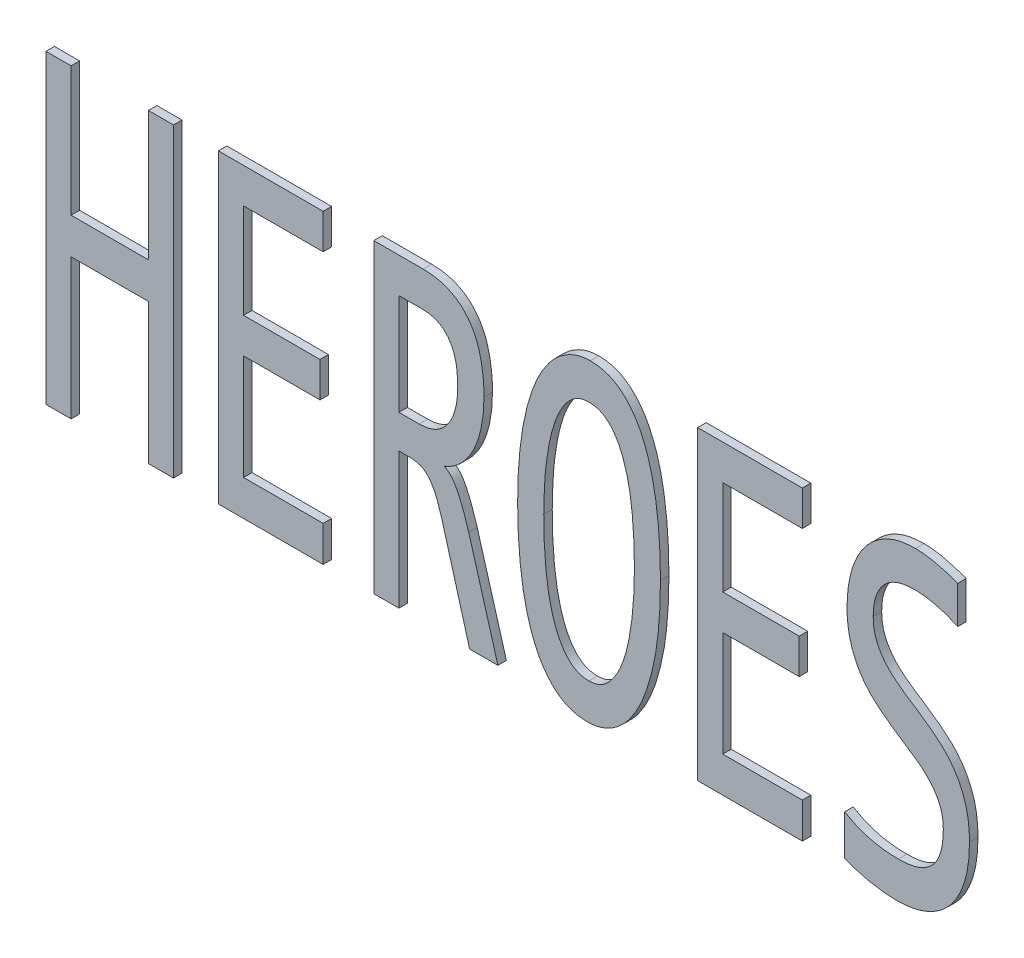
from build123d import *

# Parameters (mm, degrees)
BOSS_EXTRUDE1_DEPTH   = 25.4
BOSS_EXTRUDE1_2_DEPTH = 25.4
BOSS_EXTRUDE1_3_DEPTH = 25.4
BOSS_EXTRUDE1_4_DEPTH = 25.4
BOSS_EXTRUDE1_5_DEPTH = 25.4
BOSS_EXTRUDE1_6_DEPTH = 25.4


with BuildPart() as part:
    # Sketch1 → Boss-Extrude1 (new body)
    with BuildSketch(Plane.XY):
        Polygon((427.867059624, 0), (352.824484244, 0), (352.824484244, 419.782362276), (121.685060077, 419.782362276), (121.685060077, 0), (46.642484697, 0), (46.642484697, 914.4), (121.685060077, 914.4), (121.685060077, 527.57832691), (352.824484244, 527.57832691), (352.824484244, 914.4), (427.867059624, 914.4), align=None)
    extrude(amount=BOSS_EXTRUDE1_DEPTH)


with BuildPart() as body_2:
    # Sketch1 → Boss-Extrude1 2 (new body)
    with BuildSketch(Plane.XY):
        Polygon((875.220312854, 0), (562.197415552, 0), (562.197415552, 914.4), (875.220312854, 914.4), (875.220312854, 809.506234414), (637.239990932, 809.506234414), (637.239990932, 526.127227386), (865.891815915, 526.127227386), (865.891815915, 421.2334618), (637.239990932, 421.2334618), (637.239990932, 106.34486511), (875.220312854, 106.34486511), align=None)
    extrude(amount=BOSS_EXTRUDE1_2_DEPTH)


with BuildPart() as body_3:
    # Sketch1 → Boss-Extrude1 3 (new body)
    with BuildSketch(Plane.XY):
        with BuildLine():
            Line((1397.823441397, 0), (1313.245069145, 0))
            Line((1313.245069145, 0), (1230.946996146, 292.500204035))
            add(Edge.make_bspline(
                [(1230.946996146, 292.500204035), (1227.979518294, 302.771324606), (1222.546695751, 321.57556786), (1213.096231071, 346.863351802), (1202.953237547, 366.967967822), (1192.083790683, 382.586832065), (1180.311745272, 394.277562879), (1167.142347377, 402.126164109), (1152.563959108, 406.303675145), (1142.455396668, 406.85369441), (1137.247426887, 407.137066425)],
                knots=[0, 0, 0, 0, 1.597716288, 2.925079646, 4.029118855, 4.95483166, 5.758333448, 6.489909429, 7.2219956, 8, 8, 8, 8], degree=3))
            Line((1137.247426887, 407.137066425), (1101.799138517, 407.137066425))
            Line((1101.799138517, 407.137066425), (1101.799138517, 0))
            Line((1101.799138517, 0), (1026.756563138, 0))
            Line((1026.756563138, 0), (1026.756563138, 914.4))
            Line((1026.756563138, 914.4), (1174.146814781, 914.4))
            add(Edge.make_bspline(
                [(1174.146814781, 914.4), (1181.898188678, 914.228278779), (1196.924702681, 913.895386654), (1218.579968137, 910.561725178), (1238.486929114, 904.95554821), (1256.674416627, 897.177581238), (1273.379235464, 887.67019673), (1288.369232426, 876.164398357), (1301.830726141, 862.951477663), (1313.566458895, 847.940826388), (1324.089949237, 831.398133709), (1332.94682864, 813.164772671), (1340.181413566, 793.183858664), (1346.153657472, 771.770464689), (1350.597077572, 748.947014088), (1354.000197251, 724.946575766), (1355.794225717, 699.734284683), (1356.03400427, 682.502961384), (1356.156155067, 673.724778962)],
                knots=[0, 0, 0, 0, 1.084866721, 2.103080717, 3.058771504, 3.973613724, 4.866598079, 5.743338747, 6.612355622, 7.500977648, 8.405681801, 9.353452431, 10.33314081, 11.377907751, 12.463421626, 13.586957847, 14.77071982, 16, 16, 16, 16], degree=3))
            add(Edge.make_bspline(
                [(1356.156155067, 673.724778962), (1355.836051248, 659.8816854), (1355.208875166, 632.759056266), (1349.216118496, 593.530858206), (1340.163355749, 556.960415637), (1326.89859319, 523.893408489), (1310.097806514, 494.51804159), (1292.991429553, 473.359983954), (1277.64962045, 458.996069072), (1265.26759342, 449.889702798), (1252.287800383, 441.805046815), (1242.894117469, 437.90140806), (1238.202493766, 435.951756971)],
                knots=[0, 0, 0, 0, 1.475754456, 2.891430345, 4.223375743, 5.486798079, 6.679060895, 7.821114891, 8.374012476, 8.916543086, 9.458873353, 10, 10, 10, 10], degree=3))
            add(Edge.make_bspline(
                [(1238.202493766, 435.951756971), (1242.032634048, 433.453078043), (1249.964403927, 428.278607973), (1260.397392689, 417.612945744), (1269.605712994, 404.383141179), (1278.17802475, 388.767276487), (1286.090376518, 370.519761878), (1294.423645601, 349.819806792), (1302.717288962, 326.302732684), (1307.849424868, 309.588127561), (1310.550170029, 300.792201315)],
                knots=[0, 0, 0, 0, 0.699819309, 1.44924345, 2.269785885, 3.166405396, 4.176878175, 5.318367018, 6.588812254, 8, 8, 8, 8], degree=3))
            Line((1310.550170029, 300.792201315), (1397.823441397, 0))
        make_face()
        with BuildLine():
            add(Edge.make_bspline(
                [(1277.796780775, 663.359782362), (1277.541949658, 674.852379904), (1277.064524205, 696.383732306), (1271.962412493, 726.445269855), (1263.392108741, 751.98738049), (1251.304645946, 773.06215327), (1235.854313769, 789.563825107), (1217.239481021, 801.288316371), (1195.710930946, 808.343441684), (1180.420286839, 809.109071476), (1172.488415325, 809.506234414)],
                knots=[0, 0, 0, 0, 1.351163771, 2.531401905, 3.572722056, 4.505560823, 5.368195232, 6.20500384, 7.068863365, 8, 8, 8, 8], degree=3))
            Line((1172.488415325, 809.506234414), (1101.799138517, 809.506234414))
            Line((1101.799138517, 809.506234414), (1101.799138517, 507.262933575))
            Line((1101.799138517, 507.262933575), (1162.330718658, 507.262933575))
            add(Edge.make_bspline(
                [(1162.330718658, 507.262933575), (1170.826414673, 507.682168298), (1187.299417774, 508.495056952), (1210.506895012, 516.514249205), (1230.695992445, 529.448932997), (1247.615021643, 547.401764203), (1260.933862287, 570.095760397), (1270.489698163, 597.324829639), (1276.826103242, 628.870269637), (1277.461319048, 651.440364116), (1277.796780775, 663.359782362)],
                knots=[0, 0, 0, 0, 0.929748386, 1.802765544, 2.659017934, 3.53879539, 4.484401355, 5.525688525, 6.693299518, 8, 8, 8, 8], degree=3))
        make_face(mode=Mode.SUBTRACT)
    extrude(amount=BOSS_EXTRUDE1_3_DEPTH)


with BuildPart() as body_4:
    # Sketch1 → Boss-Extrude1 4 (new body)
    with BuildSketch(Plane.XY):
        with BuildLine():
            add(Edge.make_bspline(
                [(1883.734481977, 463.108048062), (1883.574683507, 443.270570704), (1883.266533963, 405.016702526), (1879.81894014, 349.691916761), (1874.680071132, 298.528368242), (1866.956284887, 251.487861786), (1857.459451284, 208.599987821), (1846.512320437, 169.513505194), (1833.9989034, 134.353393879), (1819.989144666, 102.99318291), (1804.265331117, 75.73568026), (1787.90188433, 51.770403755), (1769.633807411, 31.89197751), (1750.381163492, 15.562337758), (1730.078179094, 2.992683205), (1709.234239782, -6.090868019), (1687.622662663, -11.49365712), (1673.008915389, -12.259770567), (1665.654953525, -12.645295851)],
                knots=[0, 0, 0, 0, 1.665621615, 3.211924003, 4.653104377, 5.98196857, 7.212423904, 8.340265313, 9.388303699, 10.34396813, 11.219884416, 12.028020766, 12.775508547, 13.479835242, 14.141671432, 14.773311111, 15.382702934, 16, 16, 16, 16], degree=3))
            add(Edge.make_bspline(
                [(1665.654953525, -12.645295851), (1657.053254418, -12.236219338), (1640.267690367, -11.437937517), (1615.875909346, -5.462297291), (1593.292219548, 4.59076045), (1572.439277542, 18.700254), (1553.868149934, 36.944311842), (1536.380246362, 58.171933485), (1521.295504003, 83.382379759), (1507.235037026, 111.638962697), (1495.439250098, 143.630021), (1484.864476744, 178.703668774), (1476.283359636, 217.190892788), (1469.069418548, 258.693855544), (1463.538445109, 303.31925884), (1459.667860075, 350.69396238), (1457.401816412, 400.826751362), (1457.07293091, 435.120204855), (1456.903922013, 452.743051462)],
                knots=[0, 0, 0, 0, 0.735650079, 1.435565388, 2.134455729, 2.841355824, 3.577481098, 4.35511842, 5.188811928, 6.085340591, 7.052928526, 8.102480853, 9.218544296, 10.425035792, 11.706416624, 13.065252835, 14.491881282, 16, 16, 16, 16], degree=3))
            add(Edge.make_bspline(
                [(1456.903922013, 452.743051462), (1457.067079198, 472.372931117), (1457.38215837, 510.280953691), (1460.795083327, 565.12670817), (1466.047531562, 615.987385125), (1473.481337366, 662.902231716), (1482.741056164, 705.890610397), (1493.711490252, 744.928005442), (1505.995910823, 780.153164648), (1520.120839327, 811.420075808), (1535.634462222, 838.929049683), (1552.379211397, 862.676620083), (1570.294311993, 882.807314841), (1589.719623565, 898.809789824), (1609.926763279, 911.419961931), (1630.785177291, 920.487989856), (1652.325847076, 925.876488243), (1666.869683995, 926.655241812), (1674.154250737, 927.045295851)],
                knots=[0, 0, 0, 0, 1.653336302, 3.19282191, 4.626902271, 5.958966435, 7.191994487, 8.32894068, 9.372796068, 10.331429196, 11.215122592, 12.029126862, 12.77501786, 13.477806185, 14.141698318, 14.775300137, 15.386584988, 16, 16, 16, 16], degree=3))
            add(Edge.make_bspline(
                [(1674.154250737, 927.045295851), (1682.757354678, 926.645455715), (1699.629368676, 925.861307525), (1724.046370376, 919.718856926), (1746.587783112, 909.342454375), (1767.316419742, 895.002114086), (1786.174955067, 876.929618589), (1803.590389679, 855.529775526), (1818.992569134, 830.47613045), (1832.877687079, 802.133406453), (1845.030331004, 770.473611634), (1855.582111305, 735.630924665), (1864.145028116, 697.41826109), (1871.381011852, 656.122916328), (1876.809298273, 611.759214967), (1881.069439464, 564.618672406), (1883.204850875, 514.745705249), (1883.555155229, 480.591940324), (1883.734481977, 463.108048062)],
                knots=[0, 0, 0, 0, 0.737510061, 1.446371002, 2.144062571, 2.856089632, 3.598373578, 4.37797704, 5.216905352, 6.115700755, 7.082323301, 8.123178058, 9.236284327, 10.439986157, 11.71872477, 13.069688123, 14.499923588, 16, 16, 16, 16], degree=3))
        make_face()
        with BuildLine():
            add(Edge.make_bspline(
                [(1805.997007481, 453.986851054), (1805.942236052, 467.117629707), (1805.834963475, 492.834914575), (1804.267571306, 530.570435927), (1802.130296679, 566.600308326), (1798.742402379, 600.740396233), (1794.7500373, 632.933770615), (1789.44128313, 662.917427661), (1782.776395017, 690.58266607), (1775.182881553, 715.881045185), (1766.586460927, 738.767086134), (1756.739223253, 759.005482991), (1745.398626175, 776.429927201), (1733.098508617, 791.30788944), (1719.301558862, 803.196528359), (1704.085869616, 811.665626702), (1687.484570395, 816.921283907), (1675.92064413, 817.501552552), (1670.008252097, 817.798231693)],
                knots=[0, 0, 0, 0, 1.494673396, 2.92739239, 4.298855107, 5.602877083, 6.83225648, 7.991056563, 9.06712614, 10.069974831, 10.996192196, 11.847531562, 12.626450823, 13.357675176, 14.038550396, 14.686455743, 15.328412477, 16, 16, 16, 16], degree=3))
            add(Edge.make_bspline(
                [(1670.008252097, 817.798231693), (1664.306536825, 817.410050532), (1653.009247086, 816.640914431), (1636.662308167, 811.349009536), (1621.832044526, 802.017225841), (1608.426180767, 789.394826636), (1596.180377617, 773.894349993), (1585.296352253, 755.676019042), (1575.305191361, 735.100521557), (1566.741991728, 711.993832167), (1559.119161799, 686.71074256), (1552.496408531, 659.232023469), (1546.965311259, 629.61026497), (1540.852111554, 586.75691587), (1536.093428988, 529.823005534), (1535.271338587, 483.433237641), (1534.848696441, 459.583949218)],
                knots=[0, 0, 0, 0, 0.579173738, 1.147565815, 1.724351549, 2.345416426, 3.009887506, 3.725127234, 4.497589357, 5.330835328, 6.225914732, 7.179521756, 8.201254399, 9.286505257, 11.576760982, 14, 14, 14, 14], degree=3))
            add(Edge.make_bspline(
                [(1534.848696441, 459.583949218), (1534.904630459, 446.384195428), (1535.014191961, 420.529002039), (1536.562957071, 382.653536342), (1538.750870758, 346.491012199), (1542.012053343, 312.256911958), (1546.35305332, 280.0994899), (1551.605166354, 250.167606319), (1558.312832155, 222.673160533), (1565.617688608, 197.448867298), (1574.236628105, 174.781158315), (1584.253693989, 154.76577009), (1595.154735778, 137.1684608), (1607.343406897, 122.290004201), (1620.941729764, 110.316354967), (1636.144900837, 101.91341807), (1652.670941621, 96.668756323), (1664.165181212, 96.074604383), (1670.008252097, 95.772568579)],
                knots=[0, 0, 0, 0, 1.504779654, 2.947507171, 4.321014867, 5.634822696, 6.867068139, 8.019842616, 9.097516712, 10.092049308, 11.012292271, 11.85784749, 12.640311336, 13.367565975, 14.043468617, 14.69234005, 15.335254001, 16, 16, 16, 16], degree=3))
            add(Edge.make_bspline(
                [(1670.008252097, 95.772568579), (1675.709696874, 96.160944594), (1687.006450659, 96.930466775), (1703.357371273, 102.219503419), (1718.17195522, 111.562582123), (1731.682309762, 124.175555671), (1743.668353757, 139.904023718), (1755.05832443, 157.840170272), (1764.851395095, 178.532220433), (1773.702115426, 201.55931102), (1781.602259537, 226.887550769), (1788.068039786, 254.424585522), (1793.692914665, 283.955822321), (1799.770100815, 326.683305772), (1804.836499163, 383.596318787), (1805.602631534, 430.066011855), (1805.997007481, 453.986851054)],
                knots=[0, 0, 0, 0, 0.578826107, 1.146877024, 1.723316561, 2.344008663, 3.013581566, 3.726115412, 4.498113888, 5.333368672, 6.229972404, 7.189827678, 8.204052998, 9.281707645, 11.571201674, 14, 14, 14, 14], degree=3))
        make_face(mode=Mode.SUBTRACT)
    extrude(amount=BOSS_EXTRUDE1_4_DEPTH)


with BuildPart() as body_5:
    # Sketch1 → Boss-Extrude1 5 (new body)
    with BuildSketch(Plane.XY):
        Polygon((2308.077442757, 0), (1995.054545455, 0), (1995.054545455, 914.4), (2308.077442757, 914.4), (2308.077442757, 809.506234414), (2070.097120834, 809.506234414), (2070.097120834, 526.127227386), (2298.748945817, 526.127227386), (2298.748945817, 421.2334618), (2070.097120834, 421.2334618), (2070.097120834, 106.34486511), (2308.077442757, 106.34486511), align=None)
    extrude(amount=BOSS_EXTRUDE1_5_DEPTH)


with BuildPart() as body_6:
    # Sketch1 → Boss-Extrude1 6 (new body)
    with BuildSketch(Plane.XY):
        with BuildLine():
            add(Edge.make_bspline(
                [(2807.87757878, 247.723418726), (2807.670726836, 237.213588778), (2807.268446066, 216.774320003), (2804.390336146, 187.105134166), (2799.510370083, 159.408895406), (2792.392388888, 133.860323347), (2783.746816976, 110.303904248), (2773.311445081, 88.788951862), (2761.374350166, 69.276601601), (2747.773050163, 51.928268599), (2732.78040092, 36.565506393), (2716.037338932, 23.588145969), (2698.107446952, 12.143445685), (2678.594013063, 3.175349319), (2657.91301498, -3.99413532), (2636.1263074, -8.797347604), (2613.323499997, -12.109910648), (2597.756980324, -12.464168884), (2589.798050329, -12.645295851)],
                knots=[0, 0, 0, 0, 1.310582108, 2.548789095, 3.713439669, 4.813153502, 5.852028856, 6.838695823, 7.790539703, 8.699031485, 9.582618121, 10.460132505, 11.335231648, 12.229636156, 13.131688288, 14.059871096, 15.008040946, 16, 16, 16, 16], degree=3))
            add(Edge.make_bspline(
                [(2589.798050329, -12.645295851), (2582.469288478, -12.538191145), (2567.85097377, -12.324554745), (2546.171041654, -10.226958691), (2525.097511639, -6.646531308), (2504.651025303, -3.278014054), (2485.389301521, 1.754641289), (2467.188594068, 6.724524486), (2450.434312287, 12.584355464), (2439.836814427, 16.824228187), (2434.737701202, 18.864293811)],
                knots=[0, 0, 0, 0, 1.104818042, 2.203725289, 3.279421478, 4.327776895, 5.325902173, 6.279022676, 7.171931115, 8, 8, 8, 8], degree=3))
            Line((2434.737701202, 18.864293811), (2434.737701202, 139.305554296))
            add(Edge.make_bspline(
                [(2434.737701202, 139.305554296), (2445.766452904, 133.075336977), (2468.368711704, 120.307166289), (2499.699021357, 109.807210696), (2526.436908603, 102.968749668), (2548.27982185, 99.990399509), (2571.288182936, 97.414579633), (2587.094639556, 97.288316995), (2595.18784856, 97.223668102)],
                knots=[0, 0, 0, 0, 1.354118707, 2.775122905, 3.521931415, 4.308088204, 5.133708705, 6, 6, 6, 6], degree=3))
            add(Edge.make_bspline(
                [(2595.18784856, 97.223668102), (2600.995597756, 97.355640783), (2612.221093693, 97.610723904), (2628.392567083, 99.199735524), (2643.25398516, 102.093170728), (2656.831735632, 106.204342669), (2669.112495166, 111.633393445), (2680.200553137, 118.062729554), (2690.112757266, 125.635470158), (2701.831671092, 137.33664401), (2713.562528053, 155.25324581), (2723.099058285, 180.440337202), (2728.578446061, 209.344298928), (2729.19413773, 229.871050429), (2729.518204489, 240.675221038)],
                knots=[0, 0, 0, 0, 0.924336143, 1.78660119, 2.582421721, 3.330297934, 4.039326715, 4.714545517, 5.365600794, 6.018788708, 7.342499343, 8.735258537, 10.281616857, 12, 12, 12, 12], degree=3))
            add(Edge.make_bspline(
                [(2729.518204489, 240.675221038), (2729.348626724, 246.624565818), (2729.01998994, 258.154223259), (2726.795038813, 274.786134313), (2722.873499657, 290.027401071), (2715.568882307, 308.33893295), (2703.493313713, 329.243462208), (2684.783122536, 351.357371347), (2663.088488168, 371.356731079), (2638.346725517, 389.049082552), (2612.185471492, 406.233379493), (2585.34103203, 423.891241146), (2558.694263695, 442.912370417), (2532.320677203, 463.216291364), (2507.501990635, 486.447268676), (2489.361473122, 508.983843804), (2476.738486273, 529.114679781), (2467.933201292, 545.539816208), (2460.402717195, 563.349034485), (2453.609284532, 582.396882371), (2448.22541202, 603.051366897), (2444.312813681, 625.437147552), (2442.062867079, 649.70123701), (2441.744200378, 666.464512535), (2441.578598957, 675.175878486)],
                knots=[0, 0, 0, 0, 0.713732664, 1.383193179, 2.008544398, 2.5966268, 3.744190899, 4.886322036, 6.059678643, 7.27507068, 8.530490076, 9.81580041, 11.129354558, 12.457788636, 13.806529235, 15.198354101, 15.913673855, 16.65540845, 17.431555172, 18.231253257, 19.07982065, 19.988918038, 20.95490169, 22, 22, 22, 22], degree=3))
            add(Edge.make_bspline(
                [(2441.578598957, 675.175878486), (2442.111750798, 690.699512324), (2443.179734734, 721.795703498), (2451.038995824, 759.936780869), (2459.553858496, 789.573505813), (2468.215807022, 810.387886328), (2477.87410177, 830.186436885), (2489.566312205, 848.402089807), (2502.807365405, 865.363155055), (2518.070474364, 880.494233792), (2534.926716035, 894.126258627), (2553.713393439, 905.763929906), (2574.236351767, 915.381905235), (2596.745505181, 922.312952723), (2621.107101255, 926.147017751), (2637.947722944, 926.740461878), (2646.598231693, 927.045295851)],
                knots=[0, 0, 0, 0, 1.784419068, 3.57446182, 4.4624102, 5.329066767, 6.164641152, 6.993950777, 7.814717501, 8.635522733, 9.461242091, 10.304010258, 11.171942312, 12.062201348, 13.004612508, 14, 14, 14, 14], degree=3))
            add(Edge.make_bspline(
                [(2646.598231693, 927.045295851), (2651.440772812, 926.994289208), (2661.499055362, 926.88834499), (2676.971779929, 924.975734468), (2693.203719665, 922.694879684), (2709.644183713, 918.93862646), (2726.19690501, 915.252100702), (2742.296325096, 910.316227726), (2757.825157002, 905.328491372), (2767.814260527, 901.520194493), (2772.636590342, 899.681704829)],
                knots=[0, 0, 0, 0, 0.895833801, 1.860706861, 2.882899301, 3.929142895, 4.98100227, 6.021285207, 7.044757588, 8, 8, 8, 8], degree=3))
            Line((2772.636590342, 899.681704829), (2772.636590342, 787.739741555))
            add(Edge.make_bspline(
                [(2772.636590342, 787.739741555), (2761.885924869, 792.562525949), (2740.790134267, 802.026167985), (2708.204227917, 811.459655803), (2676.360031013, 817.966150006), (2655.265972722, 818.827618116), (2644.939832238, 819.249331217)],
                knots=[0, 0, 0, 0, 1.065673974, 2.091148224, 3.065562855, 4, 4, 4, 4], degree=3))
            add(Edge.make_bspline(
                [(2644.939832238, 819.249331217), (2634.880469551, 818.848656931), (2615.895239491, 818.092456589), (2589.411598823, 811.532639813), (2567.094787963, 800.245856797), (2549.469849166, 784.123404146), (2536.034140091, 764.460975666), (2526.795873311, 741.521257587), (2520.793392595, 715.697559413), (2520.231712845, 697.393553227), (2519.937973249, 687.821174337)],
                knots=[0, 0, 0, 0, 1.165861994, 2.200353925, 3.139860726, 4.036734049, 4.941847358, 5.879882033, 6.891249694, 8, 8, 8, 8], degree=3))
            add(Edge.make_bspline(
                [(2519.937973249, 687.821174337), (2520.106940698, 681.871880872), (2520.434394708, 670.342322878), (2522.67653803, 653.643250625), (2526.629467554, 638.216532884), (2533.762850191, 619.556707606), (2546.06833284, 598.451676924), (2564.505684245, 575.812574025), (2586.644627802, 556.078414996), (2611.026934844, 537.866106867), (2637.373242359, 520.888947574), (2663.956670863, 502.859586692), (2690.975444425, 484.206523239), (2717.0896444, 463.342155979), (2742.082222111, 439.832243097), (2759.858449465, 416.542712433), (2772.694440858, 396.160534031), (2781.563725462, 379.375069368), (2789.051989834, 361.202287157), (2795.808570167, 341.800152613), (2801.261172545, 320.819761628), (2805.135873487, 298.080123225), (2807.387615761, 273.473876584), (2807.710509845, 256.50388052), (2807.87757878, 247.723418726)],
                knots=[0, 0, 0, 0, 0.707630075, 1.371366539, 1.999328626, 2.597707858, 3.742592758, 4.88765467, 6.057031702, 7.260348721, 8.505033974, 9.783932162, 11.081499852, 12.408794646, 13.757372753, 15.151568017, 15.8790636, 16.621723672, 17.406361537, 18.214748258, 19.064012541, 19.981531455, 20.955622271, 22, 22, 22, 22], degree=3))
        make_face()
    extrude(amount=BOSS_EXTRUDE1_6_DEPTH)


solid = Compound([part.part, body_2.part, body_3.part, body_4.part, body_5.part, body_6.part])
